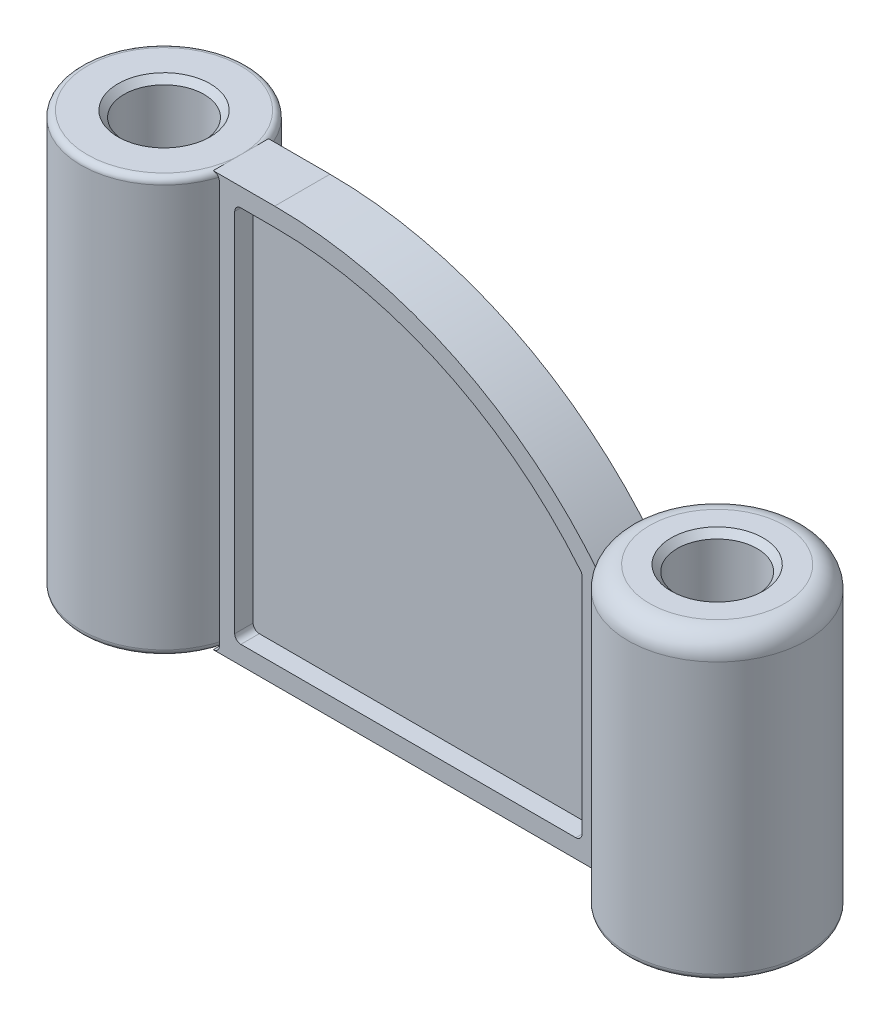
from build123d import *

# Parameters (mm, degrees)
EXTRUDE_1_DEPTH      = 9
EXTRUDE_1_DEPTH_BACK = 9
EXTRUDE_2_DEPTH      = 3
EXTRUDE_2_DEPTH_BACK = 3
SKETCH_2_R           = 13
CUT_EXTRUDE_1_DEPTH  = 135
CHAMFER_1_SIZE       = 2
CHAMFER_2_SIZE       = 2


with BuildPart() as part:
    # Эскиз1 → Повернуть1 (revolve)
    with BuildSketch(Plane.XY, mode=Mode.PRIVATE) as revolve_1_sk:
        with BuildLine():
            Line((-62, 2), (-62, 133))
            ThreePointArc((-62, 133), (-62.585786438, 134.414213562), (-64, 135))
            Line((-64, 135), (-89, 135))
            Line((-89, 135), (-89, 0))
            Line((-89, 0), (-64, 0))
            ThreePointArc((-64, 0), (-62.585786438, 0.585786438), (-62, 2))
        make_face()
    revolve(revolve_1_sk.sketch.rotate(Axis((-89, 135, 0), (0, -1, 0)), 90), axis=Axis((-89, 135, 0), (0, -1, 0)))


with BuildPart() as body_2:
    # Эскиз1<4> → Повернуть2 (revolve)
    with BuildSketch(Plane.XY):
        with BuildLine():
            Line((62, 2), (62, 90))
            ThreePointArc((62, 90), (64.050252532, 94.949747468), (69, 97))
            Line((69, 97), (91, 97))
            Line((91, 97), (91, 0))
            Line((91, 0), (64, 0))
            ThreePointArc((64, 0), (62.585786438, 0.585786438), (62, 2))
        make_face()
    revolve(axis=Axis((91, 97, 0), (0, -1, 0)))


with BuildPart() as body_3:
    # Эскиз1<5> → Бобышка-Вытянуть1 (new, two sides: drawn at the far end of the back side and taken through both)
    with BuildSketch(Plane.XY.offset(-EXTRUDE_1_DEPTH_BACK)):
        with BuildLine():
            ThreePointArc((-62, 2), (-62.585786438, 0.585786438), (-64, 0))
            Line((-64, 0), (-44, 0))
            Line((-44, 0), (64, 0))
            ThreePointArc((64, 0), (62.585786438, 0.585786438), (62, 2))
            Line((62, 2), (62, 83.600239234))
            ThreePointArc((62, 83.600239234), (14.902324671, 121.472285515), (-44, 135))
            Line((-44, 135), (-64, 135))
            ThreePointArc((-64, 135), (-62.585786438, 134.414213562), (-62, 133))
            Line((-62, 133), (-62, 2))
        make_face()
        with BuildLine():
            Line((54, 6), (-44, 6))
            Line((-44, 6), (-55, 6))
            ThreePointArc((-55, 6), (-56.414213562, 6.585786438), (-57, 8))
            Line((-57, 8), (-57, 127))
            ThreePointArc((-57, 127), (-56.414213562, 128.414213562), (-55, 129))
            Line((-55, 129), (-44, 129))
            ThreePointArc((-44, 129), (11.03002354, 116.673461032), (55.543307087, 82.049558282))
            ThreePointArc((55.543307087, 82.049558282), (55.882367415, 81.453262691), (56, 80.777472107))
            Line((56, 80.777472107), (56, 8))
            ThreePointArc((56, 8), (55.414213562, 6.585786438), (54, 6))
        make_face(mode=Mode.SUBTRACT)
    extrude(amount=EXTRUDE_1_DEPTH + EXTRUDE_1_DEPTH_BACK)

    # Эскиз1<6> → Бобышка-Вытянуть2 (add, two sides: drawn at the far end of the back side and taken through both)
    with BuildSketch(Plane.XY.offset(-EXTRUDE_2_DEPTH_BACK)):
        with BuildLine():
            Line((-44, 129), (-44, 6))
            Line((-44, 6), (54, 6))
            ThreePointArc((54, 6), (55.414213562, 6.585786438), (56, 8))
            Line((56, 8), (56, 80.777472107))
            ThreePointArc((56, 80.777472107), (55.882367415, 81.453262691), (55.543307087, 82.049558282))
            ThreePointArc((55.543307087, 82.049558282), (11.03002354, 116.673461032), (-44, 129))
        make_face()
        with BuildLine():
            Line((-55, 6), (-44, 6))
            Line((-44, 6), (-44, 129))
            Line((-44, 129), (-55, 129))
            ThreePointArc((-55, 129), (-56.414213562, 128.414213562), (-57, 127))
            Line((-57, 127), (-57, 8))
            ThreePointArc((-57, 8), (-56.414213562, 6.585786438), (-55, 6))
        make_face()
    extrude(amount=EXTRUDE_2_DEPTH + EXTRUDE_2_DEPTH_BACK)


with BuildPart() as cut_extrude_1_tool:
    # Эскиз2 → Вырез-Вытянуть1 (new body)
    with BuildSketch(Plane(origin=(0, 0, 0), x_dir=(1, 0, 0), z_dir=(0, 1, 0))):
        with Locations(Location((-89, 0, 0), (0, 0, 270))):
            Circle(SKETCH_2_R)
        with Locations((91, 0)):
            Circle(SKETCH_2_R)
    extrude(amount=CUT_EXTRUDE_1_DEPTH)


with BuildPart() as part_1:
    add(part.part)

    # Вырез-Вытянуть1: cut by cut_extrude_1_tool
    add(cut_extrude_1_tool.part, mode=Mode.SUBTRACT)

    # Фаска2
    chamfer_2_edges = [part_1.edges().sort_by_distance(p)[0] for p in [
        (-89, 135, -13),
        (-89, 0, -13),
    ]]
    chamfer(chamfer_2_edges, length=CHAMFER_2_SIZE)


with BuildPart() as body_2_1:
    add(body_2.part)

    # Вырез-Вытянуть1: cut by cut_extrude_1_tool
    add(cut_extrude_1_tool.part, mode=Mode.SUBTRACT)

    # Фаска1
    chamfer_1_edges = [body_2_1.edges().sort_by_distance(p)[0] for p in [
        (78, 97, 0),
        (78, 0, 0),
    ]]
    chamfer(chamfer_1_edges, length=CHAMFER_1_SIZE)


solid = Compound([body_3.part, part_1.part, body_2_1.part])
